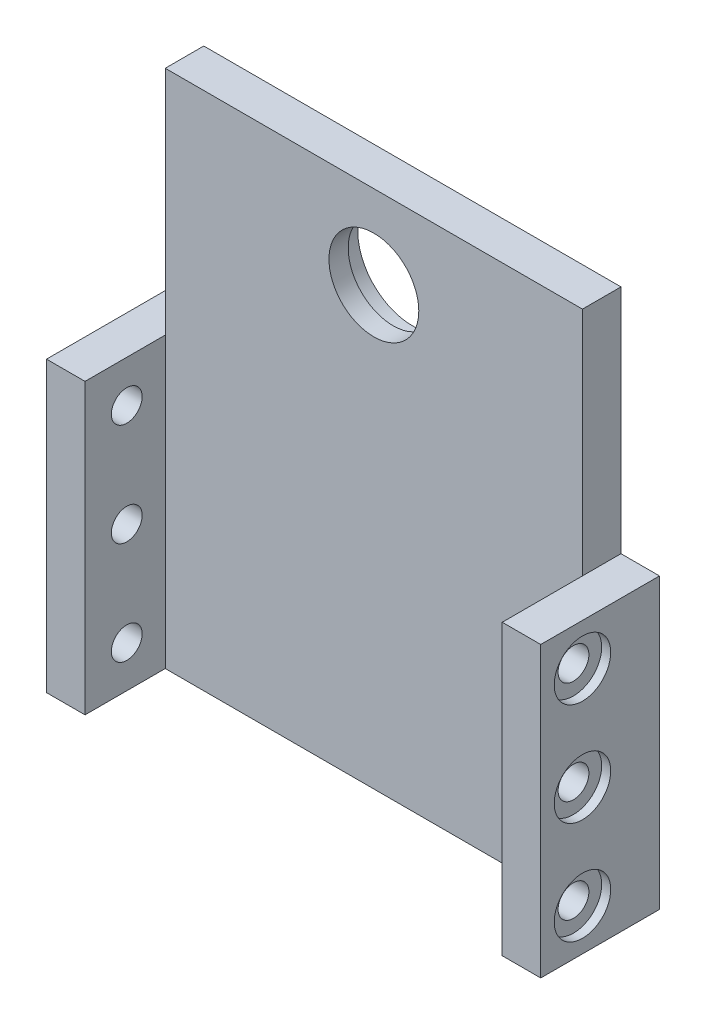
from build123d import *

# Parameters (mm, degrees)
ESBO_O1_W                                            = 32.5
ESBO_O1_H                                            = 40.5
RESSALTO_EXTRUS_O1_DEPTH                             = 3
ESBO_O4_W                                            = 9.25
ESBO_O4_H                                            = 22.5
RESSALTO_EXTRUS_O2_DEPTH                             = 3
ESBO_O5_R                                            = 4.25
CORTE_EXTRUS_O1_DEPTH                                = 1.5
ESBO_O6_R                                            = 3.5
CORTE_EXTRUS_O2_DEPTH                                = 37.217226564
REBAIXO_PARA_PARAFUSO_COM_CABE_A_REDONDA_D           = 2.4
REBAIXO_PARA_PARAFUSO_COM_CABE_A_REDONDA_DEPTH       = 3
REBAIXO_PARA_PARAFUSO_COM_CABE_A_REDONDA_CBORE_D     = 4.4
REBAIXO_PARA_PARAFUSO_COM_CABE_A_REDONDA_CBORE_DEPTH = 0.7


with BuildPart() as part:
    # Esboço1 → Ressalto-extrusão1 (new body)
    with BuildSketch(Plane.XY):
        with Locations((0, 9)):
            Rectangle(ESBO_O1_W, ESBO_O1_H)
    extrude(amount=-RESSALTO_EXTRUS_O1_DEPTH)

    # Esboço4 → Ressalto-extrusão2 (add)
    with BuildSketch(Plane.ZY.offset(16.25)):
        with Locations((1.625, 0)):
            Rectangle(ESBO_O4_W, ESBO_O4_H)
    ressalto_extrus_o2 = extrude(amount=RESSALTO_EXTRUS_O2_DEPTH)

    # Espelhar1: Ressalto-extrusão2 across plane
    add(ressalto_extrus_o2.mirror(Plane(origin=(0, 0, 0), x_dir=(0, 0, 1), z_dir=(1, 0, 0))))

    # Esboço5 → Corte-extrusão1 (cut)
    with BuildSketch(Plane(origin=(0, 0, -3), x_dir=(-1, 0, 0), z_dir=(0, 0, -1))):
        with Locations((0, 22.75)):
            Circle(ESBO_O5_R)
    extrude(amount=-CORTE_EXTRUS_O1_DEPTH, mode=Mode.SUBTRACT)

    # Esboço6 → Corte-extrusão2 (cut, through all)
    with BuildSketch(Plane(origin=(0, 0, -3), x_dir=(-1, 0, 0), z_dir=(0, 0, -1))):
        with Locations(Location((0, 22.75, 0), (0, 0, 180))):
            Circle(ESBO_O6_R)
    extrude(amount=-CORTE_EXTRUS_O2_DEPTH, mode=Mode.SUBTRACT)

    # Rebaixo para parafuso com cabeça redonda de M21
    with Locations(Plane.ZY.offset(19.25)):
        with Locations((3, 8), (3, 0), (3, -8)):
            rebaixo_para_parafuso_com_cabe_a_redonda = CounterBoreHole(REBAIXO_PARA_PARAFUSO_COM_CABE_A_REDONDA_D / 2, REBAIXO_PARA_PARAFUSO_COM_CABE_A_REDONDA_CBORE_D / 2, REBAIXO_PARA_PARAFUSO_COM_CABE_A_REDONDA_CBORE_DEPTH, depth=REBAIXO_PARA_PARAFUSO_COM_CABE_A_REDONDA_DEPTH)

    # Espelhar3: Rebaixo para parafuso com cabeça redonda de M21 across plane
    add(rebaixo_para_parafuso_com_cabe_a_redonda.mirror(Plane(origin=(0, 0, 0), x_dir=(0, 0, 1), z_dir=(1, 0, 0))), mode=Mode.SUBTRACT)


solid = part.part
